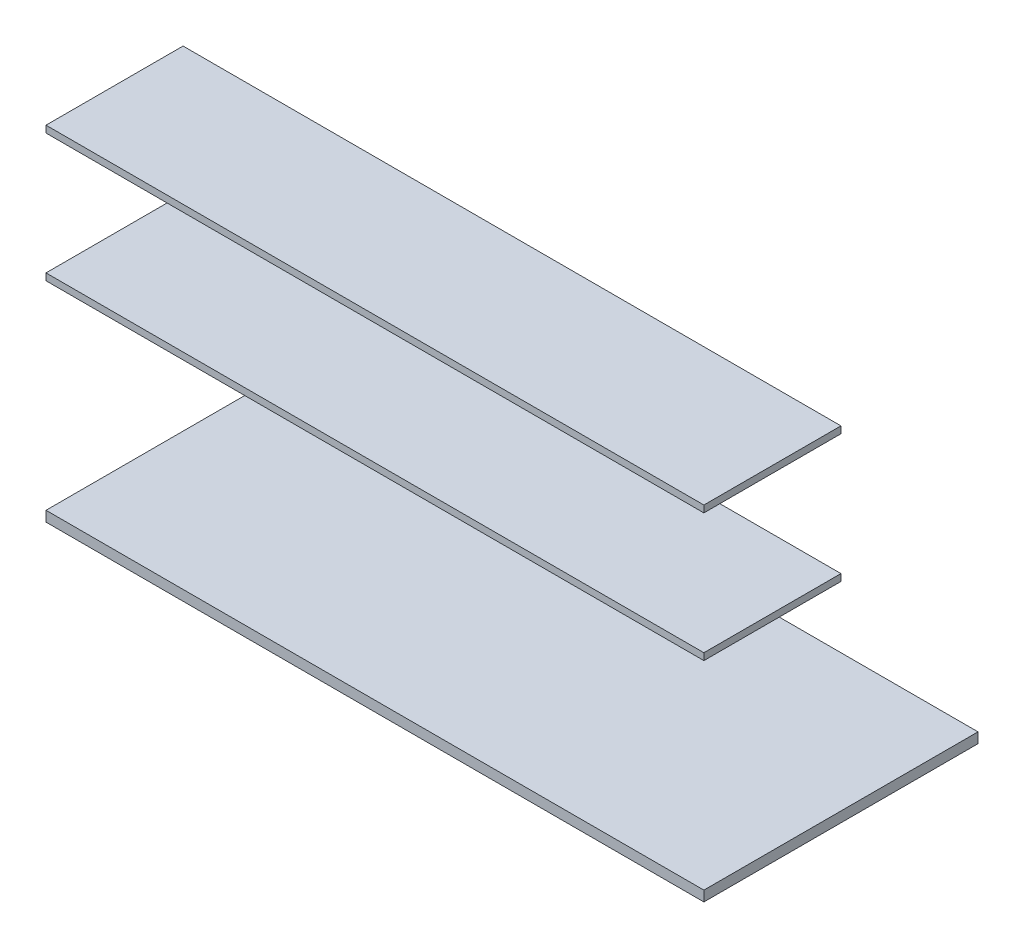
from build123d import *

# Parameters (mm, degrees)
SKETCH1_W             = 762
SKETCH1_H             = 28.575
BOSS_EXTRUDE1_DEPTH   = 1828.8
SKETCH1_W_2           = 381
SKETCH1_H_2           = 19.05
BOSS_EXTRUDE1_2_DEPTH = 1828.8
BOSS_EXTRUDE1_3_DEPTH = 1828.8


with BuildPart() as part:
    # Sketch1 → Boss-Extrude1 (new body)
    with BuildSketch(Plane(origin=(0, 0, 0), x_dir=(0, 0, -1), z_dir=(1, 0, 0))):
        with Locations((381, 14.2875)):
            Rectangle(SKETCH1_W, SKETCH1_H)
    extrude(amount=-BOSS_EXTRUDE1_DEPTH)


with BuildPart() as body_2:
    # Sketch1 → Boss-Extrude1 2 (new body)
    with BuildSketch(Plane(origin=(0, 0, 0), x_dir=(0, 0, -1), z_dir=(1, 0, 0))):
        with Locations((190.5, 590.55)):
            Rectangle(SKETCH1_W_2, SKETCH1_H_2)
    extrude(amount=-BOSS_EXTRUDE1_2_DEPTH)


with BuildPart() as body_3:
    # Sketch1 → Boss-Extrude1 3 (new body)
    with BuildSketch(Plane(origin=(0, 0, 0), x_dir=(0, 0, -1), z_dir=(1, 0, 0))):
        with Locations((190.5, 946.15)):
            Rectangle(SKETCH1_W_2, SKETCH1_H_2)
    extrude(amount=-BOSS_EXTRUDE1_3_DEPTH)


solid = Compound([part.part, body_2.part, body_3.part])
